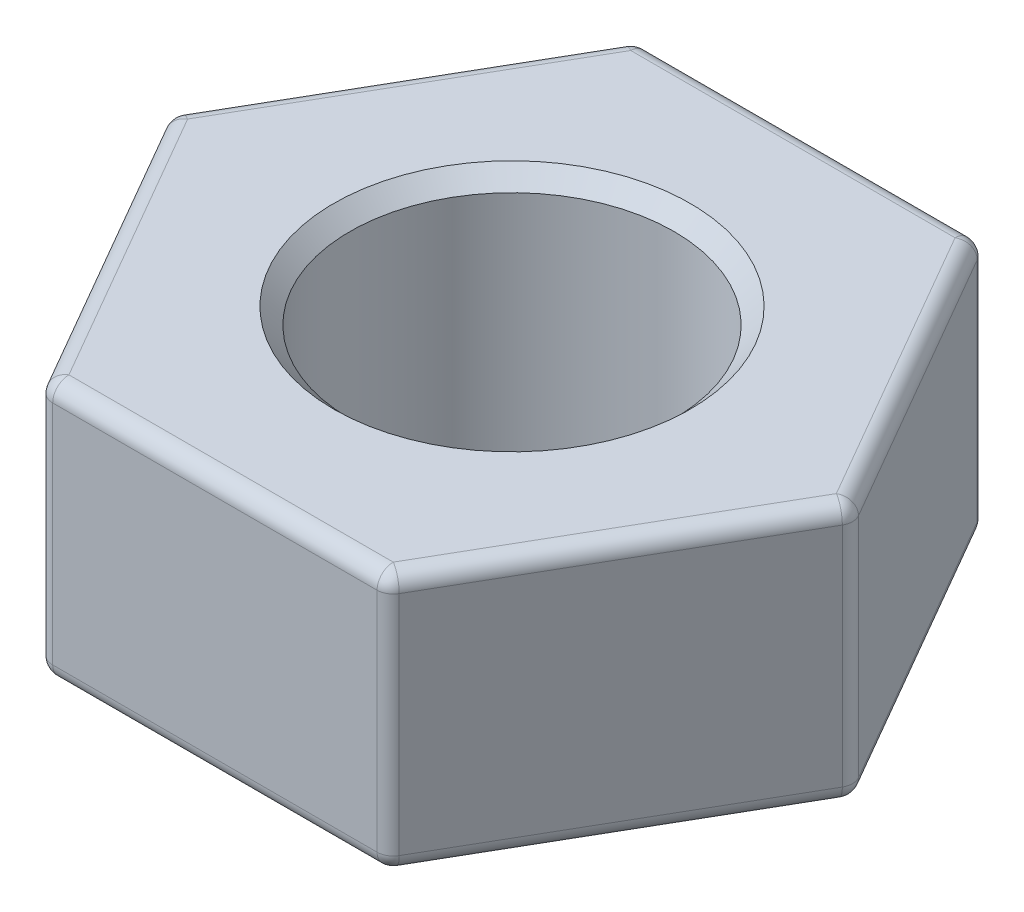
from build123d import *

# Parameters (mm, degrees)
SKETCH_1_R      = 1.5
EXTRUDE_1_DEPTH = 2.4
FILLET_1_R      = 0.15
CHAMFER_1_SIZE  = 0.15


with BuildPart() as part:
    # 草图1 → 凸台-拉伸1 (new body)
    with BuildSketch(Plane(origin=(0, 0, 0), x_dir=(1, 0, 0), z_dir=(0, 1, 0))):
        Polygon((3.175426481, 0), (1.58771324, 2.75), (-1.58771324, 2.75), (-3.175426481, 0), (-1.58771324, -2.75), (1.58771324, -2.75), align=None)
        with Locations(Location((0, 0, 0), (0, 0, 270))):
            Circle(SKETCH_1_R, mode=Mode.SUBTRACT)
    extrude(amount=EXTRUDE_1_DEPTH)

    # 圆角1
    fillet_1_edges = [part.edges().sort_by_distance(p)[0] for p in [
        (1.58771324, 1.2, 2.75),
        (-1.58771324, 1.2, 2.75),
        (-3.175426481, 1.2, 0),
        (-1.58771324, 1.2, -2.75),
        (1.58771324, 1.2, -2.75),
        (3.175426481, 1.2, 0),
        (0, 2.4, -2.75),
        (-2.38156986, 2.4, -1.375),
        (-2.38156986, 2.4, 1.375),
        (0, 2.4, 2.75),
        (2.38156986, 2.4, 1.375),
        (0, 0, 2.75),
        (-2.38156986, 0, 1.375),
        (-2.38156986, 0, -1.375),
        (0, 0, -2.75),
        (2.38156986, 0, -1.375),
        (2.38156986, 0, 1.375),
        (2.38156986, 2.4, -1.375),
    ]]
    fillet(fillet_1_edges, radius=FILLET_1_R)

    # 倒角1
    chamfer_1_edges = [part.edges().sort_by_distance(p)[0] for p in [
        (0, 0, -1.5),
        (0, 2.4, -1.5),
    ]]
    chamfer(chamfer_1_edges, length=CHAMFER_1_SIZE)


solid = part.part
